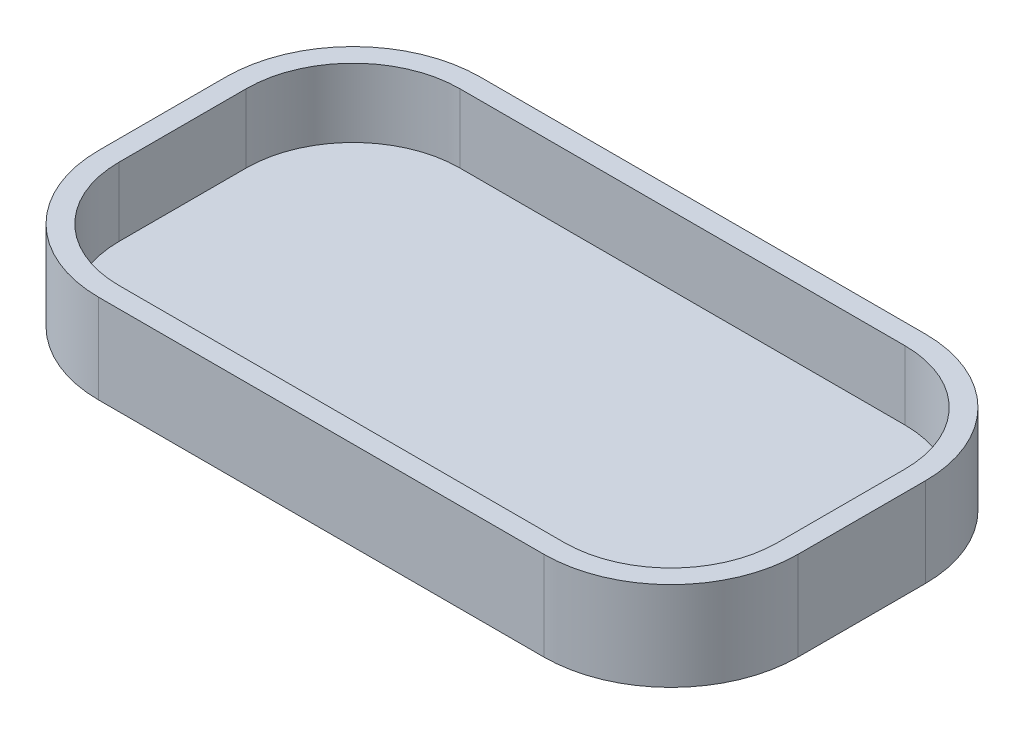
from build123d import *

# Parameters (mm, degrees)
SKICA1_W                = 55
SKICA1_H                = 30
P_IDAT_VYSUNUT_M1_DEPTH = 7
ZAOBLIT1_R              = 10
SKO_EPINA1_T            = -1.6


with BuildPart() as part:
    # Skica1 → Přidat vysunutím1 (new body)
    with BuildSketch(Plane(origin=(0, 0, 0), x_dir=(1, 0, 0), z_dir=(0, 1, 0))):
        with Locations((-27.5, 15)):
            Rectangle(SKICA1_W, SKICA1_H)
    extrude(amount=P_IDAT_VYSUNUT_M1_DEPTH)

    # Zaoblit1
    zaoblit1_edges = [part.edges().sort_by_distance(p)[0] for p in [
        (0, 3.5, 0),
        (-55, 3.5, 0),
        (-55, 3.5, -30),
        (0, 3.5, -30),
    ]]
    fillet(zaoblit1_edges, radius=ZAOBLIT1_R)

    # Skořepina1
    sko_epina1_openings = [part.faces().sort_by_distance(p)[0] for p in [
        (-27.5, 7, -15),
    ]]
    offset(amount=SKO_EPINA1_T, openings=sko_epina1_openings, kind=Kind.INTERSECTION)


solid = part.part
